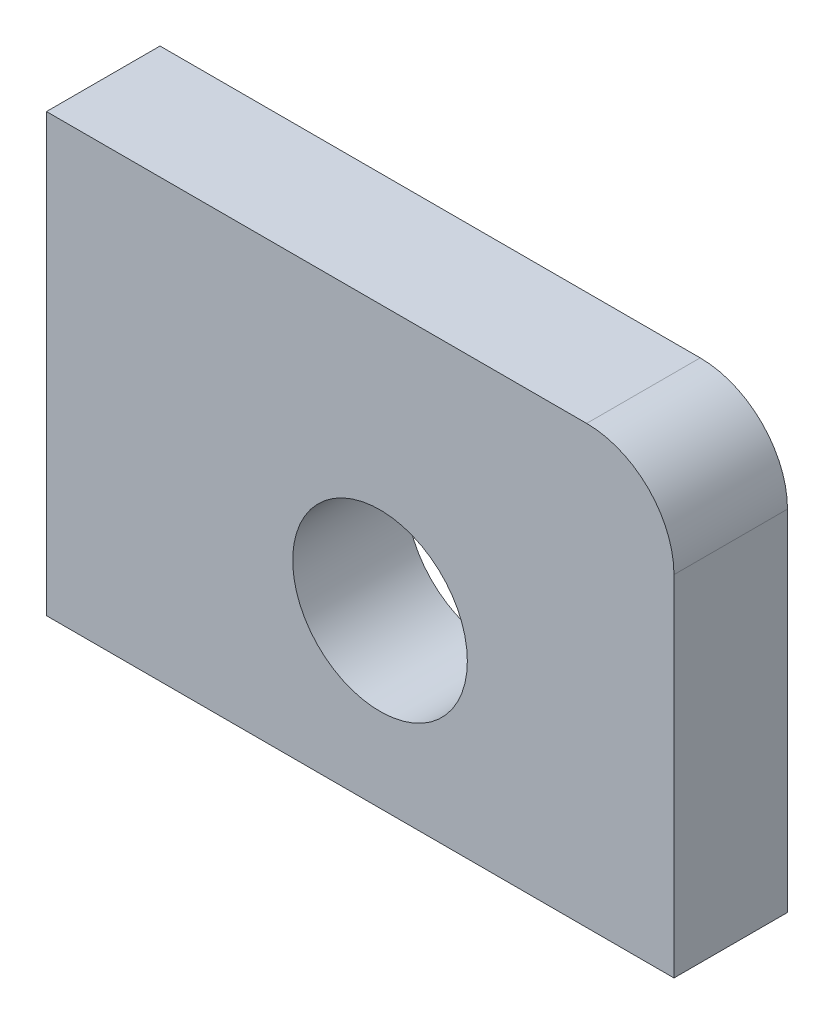
from build123d import *

# Parameters (mm, degrees)
SKETCH_2_W          = 100
SKETCH_2_H          = 50
EXTRUDE_1_DEPTH     = 13
FILLET_1_R          = 10
SKETCH_3_R          = 10
CUT_EXTRUDE_1_DEPTH = 13
SKETCH_4_W          = 28.145361764
SKETCH_4_H          = 50
CUT_EXTRUDE_2_DEPTH = 13


with BuildPart() as part:
    # 草图2 → 凸台-拉伸1 (new body)
    with BuildSketch(Plane.XY):
        with Locations((-8.273923568, 5.39517388)):
            Rectangle(SKETCH_2_W, SKETCH_2_H)
    extrude(amount=EXTRUDE_1_DEPTH)

    # 圆角1
    fillet_1_edges = [part.edges().sort_by_distance(p)[0] for p in [
        (41.726076432, 30.39517388, 6.5),
    ]]
    fillet(fillet_1_edges, radius=FILLET_1_R)

    # 草图3 → 切除-拉伸1 (cut)
    with BuildSketch(Plane.XY.offset(13)):
        with Locations((8.064626437, 0)):
            Circle(SKETCH_3_R)
    extrude(amount=-CUT_EXTRUDE_1_DEPTH, mode=Mode.SUBTRACT)

    # 草图4 → 切除-拉伸2 (cut)
    with BuildSketch(Plane.XY.offset(13)):
        with Locations((-44.201242686, 5.39517388)):
            Rectangle(SKETCH_4_W, SKETCH_4_H)
    extrude(amount=-CUT_EXTRUDE_2_DEPTH, mode=Mode.SUBTRACT)


solid = part.part
